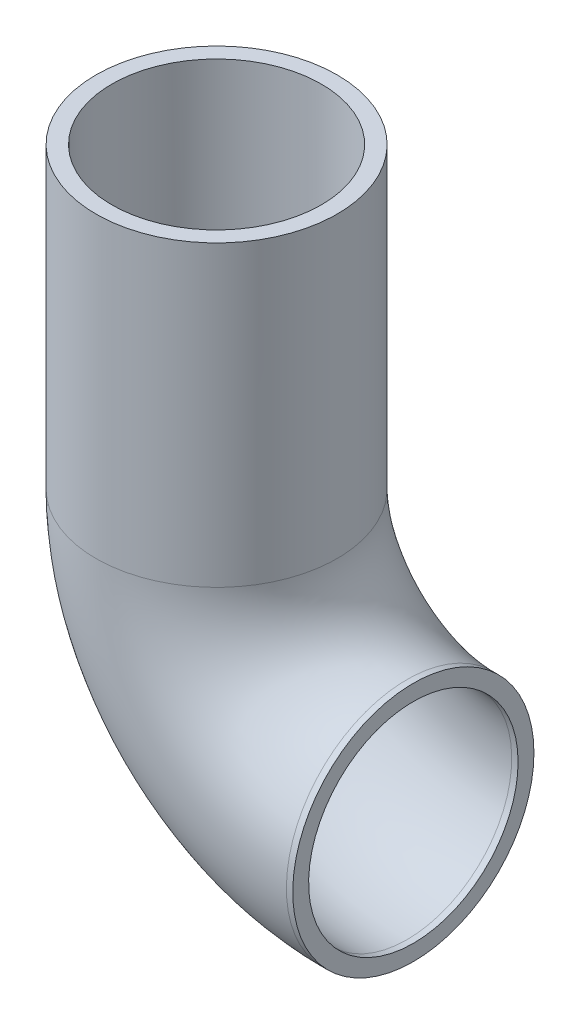
from build123d import *

# Parameters (mm, degrees)
SKETCH2_R   = 19
SKETCH2_R_2 = 16.5


with BuildPart() as part:
    # Sweep-Thin1: sweep along a path in Sketch1
    with BuildLine(Plane.XY) as sweep_thin1_path:
        Line((0, 0), (-1, 0))
        ThreePointArc((-1, 0), (-22.213203436, 8.786796564), (-31, 30))
        Line((-31, 30), (-31, 77))
    # Sketch2 → Sweep-Thin1 (sweep)
    with BuildSketch(Plane(origin=(0, 0, 0), x_dir=(0, 0, -1), z_dir=(1, 0, 0))):
        Circle(SKETCH2_R)
        Circle(SKETCH2_R_2, mode=Mode.SUBTRACT)
    sweep(path=sweep_thin1_path.line)


solid = part.part
